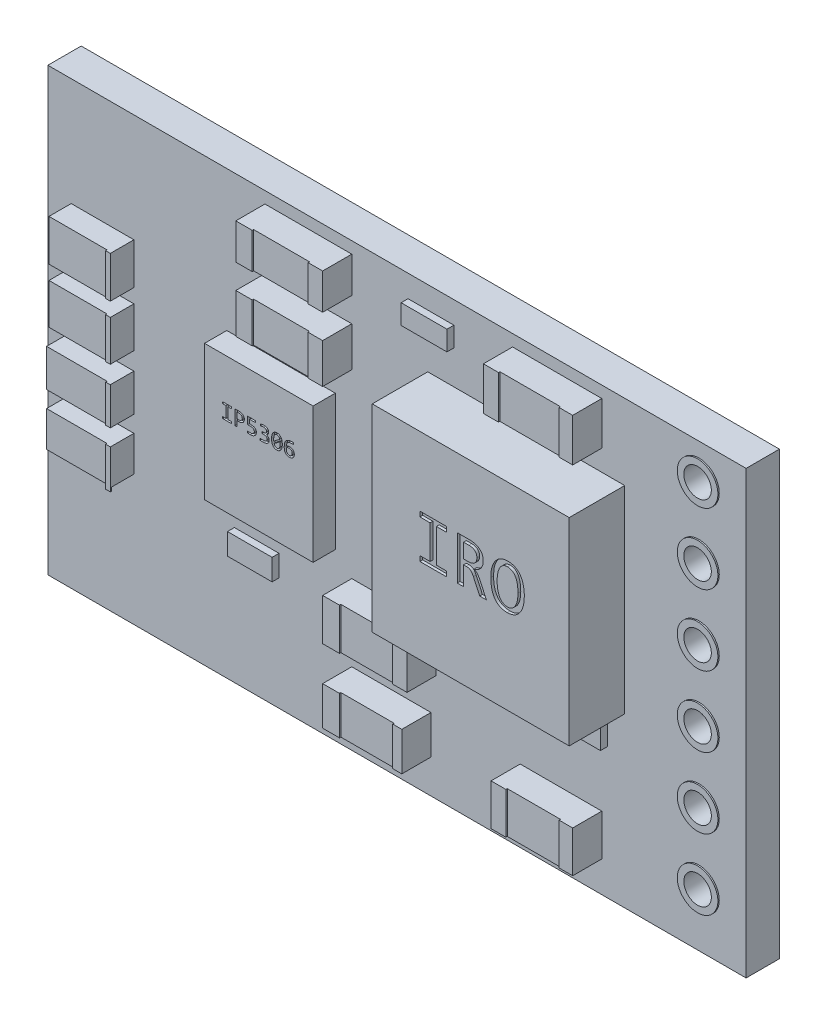
from build123d import *

# Parameters (mm, degrees)
ESQUISSE3_W             = 25.154181236
ESQUISSE3_H             = 15.900570523
BOSS_EXTRU_1_DEPTH      = 1.2
CONDO_W                 = 7.09588302
CONDO_H                 = 7.124845808
BOSS_EXTRU_2_DEPTH      = 2
IC_ET_DIODES_W          = 3.909976358
IC_ET_DIODES_H          = 4.88022975
IC_ET_DIODES_W_2        = 2.259097451
IC_ET_DIODES_H_2        = 1.491583574
IC_ET_DIODES_H_3        = 1.462620786
IC_ET_DIODES_W_3        = 2.345985815
IC_ET_DIODES_H_4        = 1.346769634
IC_ET_DIODES_H_5        = 1.274362665
BOSS_EXTRU_3_DEPTH      = 0.8
RESISTRORS_W            = 1.650878906
RESISTRORS_H            = 0.709588302
RESISTRORS_W_2          = 1.607434725
RESISTRORS_H_2          = 0.767513877
RESISTRORS_W_3          = 1.535027755
RESISTRORS_H_3          = 0.73855109
RESISTRORS_H_4          = 0.854402241
BOSS_EXTRU_4_DEPTH      = 0.25
RESISTORS_W             = 3.127981086
RESISTORS_H             = 1.288844058
RESISTORS_H_2           = 1.433657998
RESISTORS_W_2           = 3.214869449
RESISTORS_H_3           = 1.549509149
RESISTORS_W_3           = 3.041092723
RESISTORS_H_4           = 1.506064967
RESISTORS_W_4           = 2.852834602
RESISTORS_H_5           = 1.390213816
RESISTORS_W_5           = 2.939722965
RESISTORS_H_6           = 1.491583574
BOSS_EXTRU_5_DEPTH      = 1
PINS_R                  = 0.49578427
ENL_V_MAT_EXTRU_1_DEPTH = 11
ENL_V_MAT_EXTRU_4_DEPTH = 0.1
ENL_V_MAT_EXTRU_5_DEPTH = 0.1
BOSS_EXTRU_6_START      = 0.05
ESQUISSE14_R            = 0.73159052
ESQUISSE14_R_2          = 0.49578427
BOSS_EXTRU_6_DEPTH      = 0.05
CATHODE_DIODES_W        = 0.167033862
CATHODE_DIODES_H        = 1.491583574
CATHODE_DIODES_H_2      = 1.462620786
CATHODE_DIODES_H_3      = 1.346769634
CATHODE_DIODES_H_4      = 1.402853489
BOSS_EXTRU_7_DEPTH      = 0.05
SOUDURECAPA_W           = 0.59218374
SOUDURECAPA_H           = 1.288844058
SOUDURECAPA_W_2         = 0.526608544
SOUDURECAPA_H_2         = 1.433657998
SOUDURECAPA_W_3         = 0.607610942
SOUDURECAPA_H_3         = 1.506064967
SOUDURECAPA_W_4         = 0.521511792
SOUDURECAPA_W_5         = 0.333253671
SOUDURECAPA_H_4         = 1.390213816
SOUDURECAPA_W_6         = 0.535067026
SOUDURECAPA_H_5         = 1.491583574
SOUDURECAPA_W_7         = 0.492685949
SOUDURECAPA_H_6         = 1.549509149
SOUDURECAPA_W_8         = 0.542679997
BOSS_EXTRU_8_DEPTH      = 0.05


with BuildPart() as part:
    # Esquisse3 → Boss.-Extru.1 (new body)
    with BuildSketch(Plane.XY):
        with Locations((619.303098816, 274.253303188)):
            Rectangle(ESQUISSE3_W, ESQUISSE3_H)
    extrude(amount=-BOSS_EXTRU_1_DEPTH)

    # condo → Boss.-Extru.2 (add)
    with BuildSketch(Plane.XY):
        with Locations((623.958866961, 275.918663488)):
            Rectangle(CONDO_W, CONDO_H)
    extrude(amount=BOSS_EXTRU_2_DEPTH)

    # ic et diodes → Boss.-Extru.3 (add)
    with BuildSketch(Plane.XY):
        with Locations((615.12521667, 274.709467096)):
            Rectangle(IC_ET_DIODES_W, IC_ET_DIODES_H)
        with Locations((608.695477771, 277.562301698)):
            Rectangle(IC_ET_DIODES_W_2, IC_ET_DIODES_H_2)
        with Locations((608.695477771, 275.578350731)):
            Rectangle(IC_ET_DIODES_W_2, IC_ET_DIODES_H_3)
        with Locations((608.652033588, 273.536474189)):
            Rectangle(IC_ET_DIODES_W_3, IC_ET_DIODES_H_4)
        with Locations((608.652033588, 271.632170889)):
            Rectangle(IC_ET_DIODES_W_3, IC_ET_DIODES_H_5)
    extrude(amount=BOSS_EXTRU_3_DEPTH)

    # resistrors → Boss.-Extru.4 (add)
    with BuildSketch(Plane.XY):
        with Locations((620.526776602, 281.052317632)):
            Rectangle(RESISTRORS_W, RESISTRORS_H)
        with Locations((614.249092339, 270.756046556)):
            Rectangle(RESISTRORS_W_2, RESISTRORS_H_2)
        with Locations((623.292722841, 271.50907904)):
            Rectangle(RESISTRORS_W_3, RESISTRORS_H_3)
        with Locations((626.080391169, 271.451153465)):
            Rectangle(RESISTRORS_W_2, RESISTRORS_H_4)
    extrude(amount=BOSS_EXTRU_4_DEPTH)

    # resistors → Boss.-Extru.5 (add)
    with BuildSketch(Plane.XY):
        with Locations((616.109951457, 281.139205996)):
            Rectangle(RESISTORS_W, RESISTORS_H)
        with Locations((616.109951457, 278.894589939)):
            Rectangle(RESISTORS_W, RESISTORS_H_2)
        with Locations((625.073934293, 281.008873451)):
            Rectangle(RESISTORS_W_2, RESISTORS_H_3)
        with Locations((619.194488362, 270.908101192)):
            Rectangle(RESISTORS_W_3, RESISTORS_H_4)
        with Locations((619.100359301, 268.214561924)):
            Rectangle(RESISTORS_W_4, RESISTORS_H_5)
        with Locations((625.211507535, 268.163877045)):
            Rectangle(RESISTORS_W_5, RESISTORS_H_6)
    extrude(amount=BOSS_EXTRU_5_DEPTH)

    # pins → Enlèv. mat.-Extru.1 (cut)
    with BuildSketch(Plane(origin=(0, -0.129440995, 0), x_dir=(1, 0, 0), z_dir=(0, 0, 1))):
        with Locations((630.181608252, 281.075407199)):
            Circle(PINS_R)
        with Locations((630.181608252, 278.535407199)):
            Circle(PINS_R)
        with Locations((630.181608252, 275.995407199)):
            Circle(PINS_R)
        with Locations((630.181608252, 273.455407199)):
            Circle(PINS_R)
        with Locations((630.181608252, 270.915407199)):
            Circle(PINS_R)
        with Locations((630.181608252, 268.375407199)):
            Circle(PINS_R)
    extrude(amount=-ENL_V_MAT_EXTRU_1_DEPTH, mode=Mode.SUBTRACT)

    # Esquisse11 → Enlèv. mat.-Extru.4 (cut)
    # profile 1 of 6: a face of its own
    with BuildSketch(Plane.XY.offset(0.8)):
        Polygon((613.943659437, 275.592581959), (613.822152418, 275.592581959), (613.822152418, 275.653335469), (614.141108345, 275.653335469), (614.141108345, 275.592581959), (614.019601325, 275.592581959), (614.019601325, 275.190089956), (614.141108345, 275.190089956), (614.141108345, 275.129336446), (613.822152418, 275.129336446), (613.822152418, 275.190089956), (613.943659437, 275.190089956), align=None)
    # profile 2 of 6: a face of its own
    with BuildSketch(Plane.XY.offset(0.8)):
        with BuildLine():
            add(Edge.make_bspline(
                [(614.604353858, 275.493857506), (614.604225624, 275.488549272), (614.603968003, 275.477885076), (614.601589653, 275.461964649), (614.59790679, 275.446129535), (614.592847652, 275.430483861), (614.58621278, 275.415258762), (614.577921736, 275.400725624), (614.567786508, 275.387157455), (614.556321385, 275.374265392), (614.543065073, 275.362482464), (614.528080992, 275.351865944), (614.511411581, 275.342414242), (614.493106856, 275.334003464), (614.472926867, 275.327403194), (614.450927596, 275.322505311), (614.42703087, 275.319704753), (614.410472058, 275.319366061), (614.401921265, 275.319191164)],
                knots=[0, 0, 0, 0, 0.84837333, 1.704374698, 2.568122001, 3.446177459, 4.329841521, 5.219461111, 6.115085959, 7.03322926, 7.973947317, 8.94447037, 9.964314875, 11.034235969, 12.160282575, 13.352588404, 14.632904974, 16, 16, 16, 16], degree=3))
            Line((614.401921265, 275.319191164), (614.338557252, 275.319191164))
            Line((614.338557252, 275.319191164), (614.338557252, 275.129336446))
            Line((614.338557252, 275.129336446), (614.262615365, 275.129336446))
            Line((614.262615365, 275.129336446), (614.262615365, 275.653335469))
            Line((614.262615365, 275.653335469), (614.409159476, 275.653335469))
            add(Edge.make_bspline(
                [(614.409159476, 275.653335469), (614.415531854, 275.653267981), (614.428180436, 275.653134022), (614.446908151, 275.651340728), (614.46527368, 275.648814474), (614.483127512, 275.645037821), (614.50027102, 275.640083051), (614.516558049, 275.634035163), (614.531538735, 275.626146853), (614.545606031, 275.617307528), (614.558561603, 275.607103625), (614.569959101, 275.595262131), (614.58001116, 275.582070549), (614.588717117, 275.567559891), (614.595885108, 275.55148432), (614.600702545, 275.533672834), (614.603936609, 275.514305154), (614.604211514, 275.500833196), (614.604353858, 275.493857506)],
                knots=[0, 0, 0, 0, 1.071095419, 2.126025337, 3.160633674, 4.187194637, 5.191188192, 6.159546808, 7.102471747, 8.032359578, 8.950543616, 9.867691343, 10.788184798, 11.733733012, 12.707489344, 13.737062018, 14.82826569, 16, 16, 16, 16], degree=3))
        make_face()
        with BuildLine():
            add(Edge.make_bspline(
                [(614.528411971, 275.489823093), (614.528336217, 275.493862914), (614.528188569, 275.501736677), (614.526601434, 275.513139426), (614.524102145, 275.523828042), (614.520697753, 275.533793264), (614.516284427, 275.543064755), (614.510766094, 275.551515686), (614.504317591, 275.559322442), (614.496829663, 275.566300902), (614.488449435, 275.572443702), (614.479428458, 275.577996415), (614.469475892, 275.582483485), (614.458728671, 275.586120938), (614.447246147, 275.589144724), (614.434916989, 275.591047646), (614.421888757, 275.592460544), (614.412921253, 275.592540839), (614.408328861, 275.592581959)],
                knots=[0, 0, 0, 0, 1.07893025, 2.102875295, 3.069403633, 4.00867391, 4.911619206, 5.805799344, 6.69897942, 7.61127936, 8.532960211, 9.47193309, 10.436783978, 11.442898866, 12.50165651, 13.605056338, 14.773513735, 16, 16, 16, 16], degree=3))
            Line((614.408328861, 275.592581959), (614.338557252, 275.592581959))
            Line((614.338557252, 275.592581959), (614.338557252, 275.379944674))
            Line((614.338557252, 275.379944674), (614.402277242, 275.379944674))
            add(Edge.make_bspline(
                [(614.402277242, 275.379944674), (614.407184005, 275.380051101), (614.416695595, 275.380257405), (614.430579549, 275.38141367), (614.443609499, 275.383493416), (614.455726377, 275.38662189), (614.466982343, 275.390399006), (614.477397495, 275.395012873), (614.486918134, 275.400632173), (614.495619008, 275.407037175), (614.503440117, 275.414289309), (614.510082966, 275.422583639), (614.515831676, 275.431631098), (614.520504453, 275.441595565), (614.524001975, 275.452458539), (614.526627385, 275.464128227), (614.528188477, 275.476688656), (614.528335841, 275.485349072), (614.528411971, 275.489823093)],
                knots=[0, 0, 0, 0, 1.232805628, 2.389751021, 3.4973379, 4.54330244, 5.530003372, 6.477393866, 7.399377973, 8.301660217, 9.187431021, 10.070466494, 10.963674817, 11.874940633, 12.827061481, 13.825105319, 14.876436953, 16, 16, 16, 16], degree=3))
        make_face(mode=Mode.SUBTRACT)
    # profile 3 of 6: a face of its own
    with BuildSketch(Plane.XY.offset(0.8)):
        with BuildLine():
            add(Edge.make_bspline(
                [(615.037222617, 275.298425805), (615.037011266, 275.292006635), (615.036595186, 275.279369449), (615.033481681, 275.260811899), (615.028104221, 275.243174523), (615.020667033, 275.226499159), (615.011540979, 275.210802293), (615.000671507, 275.196267805), (614.988221604, 275.182907411), (614.974289935, 275.170639812), (614.958895129, 275.159642135), (614.942039038, 275.149973932), (614.923973571, 275.141438721), (614.904577658, 275.134363671), (614.88423918, 275.128657821), (614.862963957, 275.124625051), (614.840896568, 275.122238483), (614.825896445, 275.121909129), (614.818296394, 275.121742257)],
                knots=[0, 0, 0, 0, 0.98172717, 1.932690758, 2.868675772, 3.79512682, 4.719778069, 5.640699909, 6.565489728, 7.508663867, 8.475813283, 9.454477684, 10.477621026, 11.528583183, 12.609071962, 13.705570848, 14.837491085, 16, 16, 16, 16], degree=3))
            add(Edge.make_bspline(
                [(614.818296394, 275.121742257), (614.814261726, 275.121761394), (614.805912806, 275.121800994), (614.793130256, 275.122263345), (614.779972995, 275.123216151), (614.766740262, 275.12387457), (614.753709358, 275.125220858), (614.741108957, 275.126258955), (614.729322241, 275.127691832), (614.721824289, 275.128807221), (614.71826669, 275.129336446)],
                knots=[0, 0, 0, 0, 0.964491421, 1.995817636, 3.056882487, 4.117947338, 5.162324201, 6.187869467, 7.140187366, 8, 8, 8, 8], degree=3))
            Line((614.71826669, 275.129336446), (614.71826669, 275.190089956))
            add(Edge.make_bspline(
                [(614.71826669, 275.190089956), (614.725927911, 275.188849085), (614.742217076, 275.186210764), (614.767950758, 275.184074589), (614.795342052, 275.182802907), (614.814023089, 275.182598403), (614.82339874, 275.182495767)],
                knots=[0, 0, 0, 0, 0.882238515, 1.875801315, 2.933905742, 4, 4, 4, 4], degree=3))
            add(Edge.make_bspline(
                [(614.82339874, 275.182495767), (614.828582722, 275.182587956), (614.838733679, 275.182768475), (614.85354381, 275.184143839), (614.867517566, 275.186715429), (614.880717176, 275.189965548), (614.893032695, 275.194211105), (614.904412018, 275.199372357), (614.914879907, 275.205243843), (614.924328038, 275.21207772), (614.932784612, 275.219659304), (614.940170543, 275.228059838), (614.946691614, 275.237079371), (614.951881017, 275.247026616), (614.956049319, 275.257649775), (614.959148295, 275.268892719), (614.960957102, 275.280805644), (614.961171119, 275.28892684), (614.961280729, 275.293086141)],
                knots=[0, 0, 0, 0, 1.24924794, 2.446200838, 3.579242984, 4.670415696, 5.719433635, 6.713395331, 7.678134183, 8.606690161, 9.517812713, 10.409125339, 11.297783723, 12.193215167, 13.104786339, 14.043608292, 14.99802676, 16, 16, 16, 16], degree=3))
            add(Edge.make_bspline(
                [(614.961280729, 275.293086141), (614.961149789, 275.297084301), (614.960897255, 275.304795182), (614.959437136, 275.316020423), (614.956519284, 275.326293047), (614.952779228, 275.335857241), (614.947692199, 275.344400007), (614.941744459, 275.352318223), (614.934413412, 275.359132809), (614.926126371, 275.36524954), (614.916854089, 275.370592334), (614.906537983, 275.375046821), (614.895369743, 275.378980548), (614.883235998, 275.38219802), (614.870083979, 275.384487569), (614.856030476, 275.386272755), (614.840977007, 275.387351363), (614.830638737, 275.387474989), (614.825297287, 275.387538863)],
                knots=[0, 0, 0, 0, 1.018778499, 1.96482378, 2.874050982, 3.732757355, 4.572520443, 5.398697291, 6.246699149, 7.111119102, 8.018334738, 8.965559426, 9.969232179, 11.032231485, 12.15860358, 13.366965149, 14.639596152, 16, 16, 16, 16], degree=3))
            Line((614.825297287, 275.387538863), (614.725860878, 275.387538863))
            Line((614.725860878, 275.387538863), (614.725860878, 275.653335469))
            Line((614.725860878, 275.653335469), (615.006845862, 275.653335469))
            Line((615.006845862, 275.653335469), (615.006845862, 275.592581959))
            Line((615.006845862, 275.592581959), (614.794208577, 275.592581959))
            Line((614.794208577, 275.592581959), (614.794208577, 275.448292373))
            Line((614.794208577, 275.448292373), (614.83965505, 275.448292373))
            add(Edge.make_bspline(
                [(614.83965505, 275.448292373), (614.845865847, 275.448177375), (614.858179613, 275.447949377), (614.876573431, 275.446846544), (614.894643573, 275.444472556), (614.912424255, 275.44162742), (614.929661476, 275.43768796), (614.945972331, 275.432234822), (614.961335882, 275.42551575), (614.975739166, 275.417638965), (614.988970707, 275.408217059), (615.000975782, 275.397382144), (615.011422844, 275.384887263), (615.020677679, 275.371059512), (615.028307593, 275.355540093), (615.033402722, 275.338040091), (615.036684094, 275.318839965), (615.03703859, 275.305401817), (615.037222617, 275.298425805)],
                knots=[0, 0, 0, 0, 1.059175612, 2.099962526, 3.139743828, 4.165320853, 5.169746916, 6.150783593, 7.093036138, 8.02582832, 8.944668115, 9.856526481, 10.775316774, 11.714305364, 12.688572902, 13.710506815, 14.811478169, 16, 16, 16, 16], degree=3))
        make_face()
    # profile 4 of 6: a face of its own
    with BuildSketch(Plane.XY.offset(0.8)):
        with BuildLine():
            add(Edge.make_bspline(
                [(615.50046813, 275.290594297), (615.50026642, 275.284850561), (615.499866493, 275.273462542), (615.497254104, 275.256639587), (615.492659813, 275.240390019), (615.486425833, 275.22470479), (615.478250652, 275.20983281), (615.468552428, 275.195686643), (615.456748503, 275.182740641), (615.443332746, 275.17068219), (615.427977814, 275.159900566), (615.410955466, 275.15008408), (615.391939081, 275.141725845), (615.371164428, 275.134496731), (615.348605944, 275.128639979), (615.324209864, 275.124738363), (615.298090584, 275.122169424), (615.28004548, 275.121887552), (615.270743921, 275.121742257)],
                knots=[0, 0, 0, 0, 0.861844565, 1.708766071, 2.546803722, 3.390976017, 4.235482026, 5.088267806, 5.958166408, 6.857625573, 7.789680516, 8.767975323, 9.801402493, 10.901266619, 12.065759824, 13.293144602, 14.604719897, 16, 16, 16, 16], degree=3))
            add(Edge.make_bspline(
                [(615.270743921, 275.121742257), (615.260695496, 275.121863101), (615.241653814, 275.122092099), (615.214451952, 275.123604694), (615.189699415, 275.126196294), (615.173952934, 275.128311592), (615.166323825, 275.129336446)],
                knots=[0, 0, 0, 0, 1.150713897, 2.180593327, 3.118504498, 4, 4, 4, 4], degree=3))
            Line((615.166323825, 275.129336446), (615.166323825, 275.190089956))
            add(Edge.make_bspline(
                [(615.166323825, 275.190089956), (615.174940223, 275.188969686), (615.192576847, 275.186676641), (615.21971892, 275.184171125), (615.247867242, 275.182776637), (615.266945359, 275.182589872), (615.276558222, 275.182495767)],
                knots=[0, 0, 0, 0, 0.942811003, 1.929809335, 2.956896058, 4, 4, 4, 4], degree=3))
            add(Edge.make_bspline(
                [(615.276558222, 275.182495767), (615.282928102, 275.182594066), (615.295246753, 275.182784166), (615.312967064, 275.184026675), (615.329251259, 275.186300917), (615.344127498, 275.189352892), (615.357685523, 275.193210772), (615.369915656, 275.197994469), (615.380844354, 275.203506098), (615.390451335, 275.209875662), (615.398881313, 275.216899479), (615.406003841, 275.224742965), (615.411917332, 275.233279887), (615.416568137, 275.242525211), (615.42008755, 275.252431095), (615.422736244, 275.262950262), (615.424285128, 275.27409378), (615.424444991, 275.281729633), (615.424526243, 275.285610611)],
                knots=[0, 0, 0, 0, 1.490140128, 2.881768065, 4.152352525, 5.333691038, 6.431800578, 7.445549096, 8.401444764, 9.289364022, 10.136425943, 10.961731228, 11.759931868, 12.558561418, 13.375159002, 14.214453508, 15.092482988, 16, 16, 16, 16], degree=3))
            add(Edge.make_bspline(
                [(615.424526243, 275.285610611), (615.424415862, 275.289137652), (615.424201039, 275.296001976), (615.422427458, 275.305968217), (615.419281664, 275.315153851), (615.415128286, 275.323676512), (615.409803577, 275.331424322), (615.403629076, 275.33863227), (615.396317942, 275.345032855), (615.388049653, 275.35075386), (615.378904481, 275.355775366), (615.369017726, 275.360410791), (615.358142386, 275.363964924), (615.346548825, 275.367094358), (615.334235637, 275.36936413), (615.321343344, 275.371244893), (615.307856513, 275.372106859), (615.298669123, 275.372268406), (615.294001124, 275.372350486)],
                knots=[0, 0, 0, 0, 0.962645216, 1.873499504, 2.751163712, 3.60600831, 4.45366029, 5.311093063, 6.190880762, 7.098592726, 8.05100711, 9.036815858, 10.075001357, 11.16993685, 12.313633837, 13.491143935, 14.725281481, 16, 16, 16, 16], degree=3))
            Line((615.294001124, 275.372350486), (615.234671524, 275.372350486))
            Line((615.234671524, 275.372350486), (615.234671524, 275.433103996))
            Line((615.234671524, 275.433103996), (615.295781012, 275.433103996))
            add(Edge.make_bspline(
                [(615.295781012, 275.433103996), (615.299660613, 275.433159205), (615.30728071, 275.433267646), (615.318421086, 275.434506159), (615.329050635, 275.436391117), (615.339134744, 275.438987243), (615.348640323, 275.442281143), (615.357413944, 275.446309251), (615.36549327, 275.45098505), (615.372821281, 275.45633978), (615.379565282, 275.462213547), (615.385238737, 275.46899183), (615.390320753, 275.47624212), (615.394424486, 275.484246534), (615.397838942, 275.492797519), (615.399990637, 275.502042663), (615.401495314, 275.511765353), (615.401659844, 275.518453356), (615.401743677, 275.521861077)],
                knots=[0, 0, 0, 0, 1.192823995, 2.342878639, 3.443008352, 4.511191983, 5.54236148, 6.533123054, 7.476280357, 8.408308338, 9.321648148, 10.218966078, 11.119987697, 12.039625921, 12.979481887, 13.944359475, 14.9525951, 16, 16, 16, 16], degree=3))
            add(Edge.make_bspline(
                [(615.401743677, 275.521861077), (615.401700952, 275.525149358), (615.401617705, 275.531556372), (615.400241904, 275.540765013), (615.398258741, 275.549330211), (615.395420543, 275.557193397), (615.391726452, 275.564384474), (615.387177518, 275.570855716), (615.381790114, 275.576615619), (615.375536087, 275.581585945), (615.368590596, 275.586027203), (615.360822812, 275.589831193), (615.352275792, 275.592933725), (615.343048057, 275.595789679), (615.333011055, 275.597693053), (615.322232364, 275.599091771), (615.310711936, 275.600118962), (615.302744771, 275.600156668), (615.298628833, 275.600176148)],
                knots=[0, 0, 0, 0, 1.064287749, 2.073699511, 3.009236736, 3.9091673, 4.774588449, 5.620725501, 6.46384913, 7.320401755, 8.201989857, 9.130391188, 10.115765889, 11.145550715, 12.256343534, 13.419843727, 14.667058473, 16, 16, 16, 16], degree=3))
            add(Edge.make_bspline(
                [(615.298628833, 275.600176148), (615.289476683, 275.599890997), (615.270761502, 275.599307893), (615.247308276, 275.59555965), (615.228038168, 275.591324469), (615.212961725, 275.587389098), (615.197371083, 275.582751252), (615.186880559, 275.579207196), (615.181512203, 275.577393582)],
                knots=[0, 0, 0, 0, 1.374009053, 2.809703548, 3.557729416, 4.33717134, 5.149074242, 6, 6, 6, 6], degree=3))
            Line((615.181512203, 275.577393582), (615.181512203, 275.638147092))
            add(Edge.make_bspline(
                [(615.181512203, 275.638147092), (615.186319271, 275.639903359), (615.196123838, 275.643485468), (615.211369763, 275.647875951), (615.226997888, 275.651788815), (615.242808998, 275.654951506), (615.258550498, 275.657605596), (615.274152621, 275.659462195), (615.289391658, 275.660741878), (615.299417429, 275.660867952), (615.304324474, 275.660929658)],
                knots=[0, 0, 0, 0, 0.978322217, 1.995400233, 3.031781794, 4.058180853, 5.077730371, 6.083355555, 7.06191161, 8, 8, 8, 8], degree=3))
            add(Edge.make_bspline(
                [(615.304324474, 275.660929658), (615.311250066, 275.660816633), (615.324647461, 275.66059799), (615.344103098, 275.658893495), (615.362282341, 275.656254249), (615.379187877, 275.652347163), (615.394743819, 275.647322335), (615.40911089, 275.641581323), (615.422076218, 275.634694057), (615.433701968, 275.626821634), (615.443949192, 275.617997796), (615.452958672, 275.608324558), (615.460590885, 275.597729555), (615.466794382, 275.586221227), (615.471641219, 275.573944026), (615.4752834, 275.560919831), (615.477253328, 275.54707718), (615.477539529, 275.537608921), (615.477685564, 275.532777723)],
                knots=[0, 0, 0, 0, 1.364346343, 2.639295939, 3.84503498, 4.981142705, 6.053223054, 7.063352329, 8.025569508, 8.939887992, 9.824051135, 10.684331437, 11.538625567, 12.389464824, 13.253408307, 14.134440564, 15.048094572, 16, 16, 16, 16], degree=3))
            add(Edge.make_bspline(
                [(615.477685564, 275.532777723), (615.477444248, 275.525672018), (615.47697679, 275.511907376), (615.472437702, 275.492138597), (615.465124014, 275.474073586), (615.454530568, 275.458021382), (615.441567756, 275.443714505), (615.426420567, 275.430981166), (615.409270345, 275.419507728), (615.396534845, 275.413594573), (615.389996416, 275.410558748)],
                knots=[0, 0, 0, 0, 1.062433809, 2.058067584, 3.019272504, 3.965418163, 4.921501302, 5.900439357, 6.922081703, 8, 8, 8, 8], degree=3))
            add(Edge.make_bspline(
                [(615.389996416, 275.410558748), (615.396787601, 275.409162183), (615.410560071, 275.406329962), (615.430213925, 275.397812182), (615.448920697, 275.386898373), (615.462859412, 275.3751657), (615.472857537, 275.364619171), (615.479587957, 275.355916813), (615.485747161, 275.34662147), (615.490912994, 275.336541843), (615.495224354, 275.325885511), (615.498347289, 275.314632034), (615.500136849, 275.302795121), (615.500356274, 275.294713864), (615.50046813, 275.290594297)],
                knots=[0, 0, 0, 0, 1.405413986, 2.85016813, 4.327699737, 5.794019892, 6.533135325, 7.277475483, 8.026443619, 8.795662385, 9.574684764, 10.358501172, 11.163216512, 12, 12, 12, 12], degree=3))
        make_face()
    # profile 5 of 6: a face of its own
    with BuildSketch(Plane.XY.offset(0.8)):
        with BuildLine():
            add(Edge.make_bspline(
                [(615.971307833, 275.391098639), (615.971199591, 275.381283863), (615.970987571, 275.362059058), (615.968495819, 275.333937619), (615.9647737, 275.307096571), (615.959457857, 275.281637026), (615.952712858, 275.257646625), (615.944053402, 275.235416588), (615.934064699, 275.214850074), (615.922395283, 275.196098572), (615.909200599, 275.179289093), (615.894470608, 275.164385627), (615.878181026, 275.151532243), (615.860327338, 275.140774691), (615.840976156, 275.132081572), (615.819904632, 275.126146856), (615.797294471, 275.122328777), (615.781667218, 275.121941595), (615.773621607, 275.121742257)],
                knots=[0, 0, 0, 0, 1.248871528, 2.446241243, 3.590357027, 4.69618527, 5.754202854, 6.758290001, 7.728669934, 8.660396172, 9.563796911, 10.443071522, 11.321307858, 12.197637495, 13.090115231, 14.012601613, 14.976798049, 16, 16, 16, 16], degree=3))
            add(Edge.make_bspline(
                [(615.773621607, 275.121742257), (615.766650033, 275.121911967), (615.752918294, 275.122246241), (615.732816697, 275.125261437), (615.71370443, 275.13029369), (615.695546787, 275.137106969), (615.678561669, 275.146215958), (615.662838526, 275.15744523), (615.64830995, 275.170740144), (615.63522424, 275.186334028), (615.623451518, 275.204068403), (615.613238987, 275.224136911), (615.604409629, 275.246353641), (615.596871697, 275.270810348), (615.591182523, 275.29762717), (615.586908587, 275.326709605), (615.584449095, 275.358148031), (615.58415593, 275.379861253), (615.584004206, 275.391098639)],
                knots=[0, 0, 0, 0, 0.897102697, 1.767001224, 2.609309556, 3.43771295, 4.257811968, 5.082953918, 5.919052252, 6.786174452, 7.6970727, 8.653553743, 9.679470751, 10.771494031, 11.944028827, 13.204944144, 14.553456404, 16, 16, 16, 16], degree=3))
            add(Edge.make_bspline(
                [(615.584004206, 275.391098639), (615.584181071, 275.400911491), (615.58452814, 275.420167714), (615.586735344, 275.448394878), (615.590668483, 275.475300958), (615.596068432, 275.500809013), (615.603032703, 275.524828084), (615.611539637, 275.547147321), (615.621519133, 275.56772059), (615.633059222, 275.58649731), (615.646195248, 275.603372428), (615.660965763, 275.618279637), (615.677266367, 275.631175743), (615.695228451, 275.641895154), (615.714661189, 275.65056947), (615.735725301, 275.656512839), (615.758214746, 275.660338422), (615.773723884, 275.66072902), (615.781690432, 275.660929658)],
                knots=[0, 0, 0, 0, 1.248165713, 2.449334701, 3.598380242, 4.704508407, 5.763215836, 6.776019403, 7.739017366, 8.667464557, 9.574217704, 10.452902578, 11.330549874, 12.210601904, 13.107080692, 14.028948355, 14.987533857, 16, 16, 16, 16], degree=3))
            add(Edge.make_bspline(
                [(615.781690432, 275.660929658), (615.78866217, 275.660759948), (615.802394232, 275.660425675), (615.822455557, 275.657416165), (615.841554347, 275.652396076), (615.859639379, 275.645381057), (615.876717238, 275.636415863), (615.892398545, 275.625061507), (615.906888383, 275.611692671), (615.919939471, 275.595995149), (615.931755353, 275.578196526), (615.942061675, 275.558170594), (615.950806807, 275.535872107), (615.958252851, 275.511441689), (615.96419151, 275.484671531), (615.968386392, 275.455602615), (615.970870868, 275.424129487), (615.971158645, 275.402375962), (615.971307833, 275.391098639)],
                knots=[0, 0, 0, 0, 0.896490568, 1.765795528, 2.602608418, 3.432274242, 4.256303472, 5.076742829, 5.915718828, 6.786140009, 7.696416714, 8.659101079, 9.677705081, 10.773848187, 11.941709476, 13.20176442, 14.549356535, 16, 16, 16, 16], degree=3))
        make_face()
        with BuildLine():
            add(Edge.make_bspline(
                [(615.895365945, 275.387064226), (615.895339119, 275.391614874), (615.895285655, 275.400684413), (615.894274903, 275.414199551), (615.893430026, 275.427539687), (615.892581195, 275.436349151), (615.892162147, 275.440698184)],
                knots=[0, 0, 0, 0, 1.015676625, 2.024265076, 3.024624451, 4, 4, 4, 4], degree=3))
            Line((615.892162147, 275.440698184), (615.674778494, 275.273626032))
            add(Edge.make_bspline(
                [(615.674778494, 275.273626032), (615.676918326, 275.267215445), (615.68111541, 275.254641666), (615.689214728, 275.236915561), (615.699142231, 275.221083666), (615.711076458, 275.207605101), (615.724952275, 275.196780915), (615.737873621, 275.189874072), (615.749144956, 275.18614067), (615.758178725, 275.183939807), (615.767819433, 275.182824781), (615.774410414, 275.182606954), (615.777774679, 275.182495767)],
                knots=[0, 0, 0, 0, 1.361870802, 2.671184605, 3.91877896, 5.116024374, 6.280451232, 7.450298556, 8.047911377, 8.670688444, 9.321473259, 10, 10, 10, 10], degree=3))
            add(Edge.make_bspline(
                [(615.777774679, 275.182495767), (615.782138998, 275.182646453), (615.790743183, 275.182943529), (615.80329592, 275.185571516), (615.815276249, 275.189547913), (615.826541778, 275.195379576), (615.837171536, 275.202697031), (615.846758766, 275.21190976), (615.855785983, 275.222400367), (615.863809064, 275.234607335), (615.871040521, 275.248328186), (615.877474361, 275.263598342), (615.882858377, 275.280452109), (615.887337542, 275.298860353), (615.891023699, 275.31873765), (615.893580702, 275.340178127), (615.895142497, 275.363111011), (615.895289912, 275.378913656), (615.895365945, 275.387064226)],
                knots=[0, 0, 0, 0, 0.796240393, 1.569775284, 2.332781704, 3.095240773, 3.878796528, 4.681173991, 5.516437293, 6.40201063, 7.34239963, 8.345981007, 9.424260963, 10.57011489, 11.804224653, 13.114209461, 14.5115885, 16, 16, 16, 16], degree=3))
        make_face(mode=Mode.SUBTRACT)
        with BuildLine():
            add(Edge.make_bspline(
                [(615.659946094, 275.391929253), (615.659941159, 275.387697053), (615.659931289, 275.379232467), (615.660004871, 275.366612175), (615.660423497, 275.354178922), (615.661136775, 275.346005833), (615.661488664, 275.341973731)],
                knots=[0, 0, 0, 0, 1.015676347, 2.03139705, 3.028811753, 4, 4, 4, 4], degree=3))
            Line((615.661488664, 275.341973731), (615.878990976, 275.509045883))
            add(Edge.make_bspline(
                [(615.878990976, 275.509045883), (615.876933933, 275.515554198), (615.872933656, 275.528210749), (615.864461682, 275.545708417), (615.854785701, 275.561499933), (615.842852285, 275.574762805), (615.829346825, 275.585855391), (615.816440692, 275.592582232), (615.805399787, 275.596547396), (615.796539514, 275.598724884), (615.787177433, 275.599844237), (615.780783232, 275.600064392), (615.77753736, 275.600176148)],
                knots=[0, 0, 0, 0, 1.387569518, 2.698370158, 3.946895934, 5.144331536, 6.312393877, 7.486406228, 8.084826247, 8.697958228, 9.339048001, 10, 10, 10, 10], degree=3))
            add(Edge.make_bspline(
                [(615.77753736, 275.600176148), (615.773174584, 275.600020954), (615.764573439, 275.599714992), (615.752022531, 275.597156801), (615.740096253, 275.592933829), (615.728784568, 275.587092348), (615.718135551, 275.579609808), (615.708523185, 275.570236736), (615.699361682, 275.559572887), (615.691400847, 275.546975251), (615.684155867, 275.532968677), (615.677837187, 275.517349086), (615.672491866, 275.500181834), (615.667795899, 275.481505429), (615.664332873, 275.461266894), (615.661718077, 275.439529118), (615.660173821, 275.416237323), (615.660023561, 275.400198183), (615.659946094, 275.391929253)],
                knots=[0, 0, 0, 0, 0.786453526, 1.550480632, 2.299704824, 3.062398082, 3.840423392, 4.637837687, 5.478332318, 6.370910143, 7.318703432, 8.320397478, 9.40580758, 10.560070273, 11.791787257, 13.106920475, 14.508481623, 16, 16, 16, 16], degree=3))
        make_face(mode=Mode.SUBTRACT)
    # profile 6 of 6: a face of its own
    with BuildSketch(Plane.XY.offset(0.8)):
        with BuildLine():
            add(Edge.make_bspline(
                [(616.404176591, 275.297120553), (616.404028696, 275.291098094), (616.403737434, 275.27923756), (616.401066515, 275.261739619), (616.397189, 275.244745133), (616.391230801, 275.22848258), (616.384084068, 275.212931498), (616.375369765, 275.198372149), (616.365197495, 275.184876319), (616.353694359, 275.172451733), (616.340958519, 275.161080569), (616.326881096, 275.151108114), (616.311557559, 275.142413408), (616.295109567, 275.134938084), (616.277521105, 275.128949348), (616.258919413, 275.12492743), (616.239442559, 275.122142226), (616.226119012, 275.121877588), (616.219305559, 275.121742257)],
                knots=[0, 0, 0, 0, 1.012808932, 1.994609757, 2.972975015, 3.941440875, 4.903296596, 5.849619333, 6.790801589, 7.742283599, 8.694696427, 9.658806519, 10.639614075, 11.655415064, 12.695226034, 13.759400434, 14.854192403, 16, 16, 16, 16], degree=3))
            add(Edge.make_bspline(
                [(616.219305559, 275.121742257), (616.212216437, 275.121880323), (616.198422156, 275.122148977), (616.178405061, 275.124847025), (616.159615352, 275.129055114), (616.142089842, 275.135118272), (616.125805002, 275.142931108), (616.110946826, 275.152787547), (616.097471473, 275.16447846), (616.085389137, 275.178059445), (616.074652058, 275.1934609), (616.065453964, 275.21080452), (616.057457528, 275.22989221), (616.050964967, 275.250919385), (616.045902345, 275.273902689), (616.042309869, 275.298848616), (616.039988437, 275.325792221), (616.039769181, 275.344420888), (616.039655531, 275.354076969)],
                knots=[0, 0, 0, 0, 1.01390526, 1.972895057, 2.884568607, 3.765231935, 4.620839519, 5.462251428, 6.308844341, 7.166658115, 8.056926892, 8.988826794, 9.970611799, 11.014270175, 12.133424014, 13.334894011, 14.618554971, 16, 16, 16, 16], degree=3))
            add(Edge.make_bspline(
                [(616.039655531, 275.354076969), (616.03988617, 275.367259219), (616.040340945, 275.393252145), (616.0438682, 275.425380803), (616.047850618, 275.450336054), (616.051976085, 275.468360275), (616.056660938, 275.485904548), (616.062367697, 275.502864764), (616.068960028, 275.51922208), (616.076617919, 275.534881716), (616.085243955, 275.549827825), (616.09499721, 275.564032299), (616.105977914, 275.577343685), (616.118009322, 275.589856073), (616.131501376, 275.601167723), (616.146081484, 275.611657453), (616.162088587, 275.621064629), (616.179459272, 275.629332835), (616.198127186, 275.636593012), (616.218201883, 275.642638513), (616.239753422, 275.64754637), (616.262923649, 275.650908065), (616.287696179, 275.65292908), (616.30473618, 275.653197228), (616.313520963, 275.653335469)],
                knots=[0, 0, 0, 0, 1.867837564, 3.683025348, 4.575164874, 5.448344215, 6.302400058, 7.148024228, 7.982932617, 8.800284449, 9.616635944, 10.426804332, 11.239354919, 12.06000687, 12.8833352, 13.73118636, 14.6032312, 15.510928969, 16.455180552, 17.43944001, 18.479844542, 19.585049888, 20.754999322, 22, 22, 22, 22], degree=3))
            Line((616.313520963, 275.653335469), (616.366205647, 275.653335469))
            Line((616.366205647, 275.653335469), (616.366205647, 275.592581959))
            Line((616.366205647, 275.592581959), (616.30948655, 275.592581959))
            add(Edge.make_bspline(
                [(616.30948655, 275.592581959), (616.301846727, 275.59245859), (616.2870496, 275.592219642), (616.265684414, 275.59001282), (616.245800114, 275.586701235), (616.227533939, 275.581651782), (616.210702859, 275.575538797), (616.195378485, 275.568107532), (616.181407815, 275.55959263), (616.168937518, 275.54980341), (616.157734794, 275.539042265), (616.14801834, 275.527146818), (616.139598069, 275.514185488), (616.132644318, 275.500141721), (616.126943569, 275.485190769), (616.122642226, 275.469341686), (616.11904813, 275.452768277), (616.117862104, 275.441308152), (616.117258647, 275.43547718)],
                knots=[0, 0, 0, 0, 1.316020563, 2.548923235, 3.697425437, 4.785341311, 5.809590547, 6.778921485, 7.715223745, 8.623216841, 9.50526042, 10.386645473, 11.263804248, 12.162955214, 13.081906609, 14.016222334, 14.990643414, 16, 16, 16, 16], degree=3))
            Line((616.117258647, 275.43547718), (616.115597419, 275.425509807))
            add(Edge.make_bspline(
                [(616.115597419, 275.425509807), (616.11996376, 275.427734599), (616.128847201, 275.432260999), (616.142914115, 275.438256142), (616.158040986, 275.443251571), (616.17401096, 275.447796278), (616.190838668, 275.451494118), (616.208403644, 275.454059439), (616.226632582, 275.455653851), (616.238999626, 275.455808087), (616.245291923, 275.455886562)],
                knots=[0, 0, 0, 0, 0.873975351, 1.778126535, 2.724085452, 3.713532888, 4.738948549, 5.794572503, 6.877888282, 8, 8, 8, 8], degree=3))
            add(Edge.make_bspline(
                [(616.245291923, 275.455886562), (616.251707106, 275.455771139), (616.264144894, 275.455547356), (616.282170866, 275.453214791), (616.298988185, 275.449587488), (616.314580727, 275.444497747), (616.328910016, 275.438037397), (616.342039684, 275.43046463), (616.353891894, 275.421602433), (616.364445764, 275.411618742), (616.373846568, 275.400587221), (616.3818646, 275.388426611), (616.388842882, 275.375311682), (616.39434098, 275.361138097), (616.398727011, 275.346167524), (616.401935258, 275.330456522), (616.403876152, 275.314019268), (616.404075234, 275.302821543), (616.404176591, 275.297120553)],
                knots=[0, 0, 0, 0, 1.208685624, 2.343405611, 3.419797389, 4.447794122, 5.428919399, 6.377784689, 7.299336412, 8.211794848, 9.111090145, 10.025100823, 10.952275575, 11.906224264, 12.885336044, 13.889893727, 14.925701893, 16, 16, 16, 16], degree=3))
        make_face()
        with BuildLine():
            add(Edge.make_bspline(
                [(616.328234704, 275.296052621), (616.328169801, 275.300050014), (616.328042967, 275.307861888), (616.326953325, 275.319279778), (616.325197831, 275.330111184), (616.32270968, 275.340308768), (616.319575284, 275.349910725), (616.315373606, 275.358658051), (616.310509161, 275.366774966), (616.304620535, 275.37397507), (616.29810158, 275.380596224), (616.290684108, 275.386281911), (616.282488019, 275.391223649), (616.273482879, 275.395324263), (616.263613266, 275.39873857), (616.252813656, 275.401023505), (616.241099799, 275.402484966), (616.232995656, 275.402644575), (616.228798295, 275.402727241)],
                knots=[0, 0, 0, 0, 1.150520734, 2.248395983, 3.298528891, 4.306519537, 5.267901315, 6.199977448, 7.094361736, 7.985260264, 8.870904429, 9.763692766, 10.667808702, 11.620520663, 12.607126569, 13.668007045, 14.792196064, 16, 16, 16, 16], degree=3))
            add(Edge.make_bspline(
                [(616.228798295, 275.402727241), (616.223766386, 275.402597588), (616.21357394, 275.402334968), (616.198339519, 275.399936543), (616.183148953, 275.396399799), (616.168269038, 275.391620022), (616.153826001, 275.385979729), (616.140182584, 275.379422638), (616.127330038, 275.372560919), (616.119436221, 275.367309895), (616.115597419, 275.364756297)],
                knots=[0, 0, 0, 0, 0.996946629, 2.019377751, 3.050253168, 4.086838532, 5.114847083, 6.121490909, 7.086471756, 8, 8, 8, 8], degree=3))
            add(Edge.make_bspline(
                [(616.115597419, 275.364756297), (616.115693201, 275.35640916), (616.115876721, 275.340415948), (616.117127015, 275.317483078), (616.119378327, 275.296694372), (616.122360988, 275.277960175), (616.126440539, 275.261198842), (616.131235219, 275.24620885), (616.136896635, 275.232937776), (616.143448032, 275.221416979), (616.150842354, 275.211493923), (616.159250788, 275.203290862), (616.168310411, 275.196368129), (616.178340492, 275.191135273), (616.189092104, 275.187228414), (616.2006075, 275.184528344), (616.212887433, 275.182835341), (616.221356591, 275.182611111), (616.225713155, 275.182495767)],
                knots=[0, 0, 0, 0, 1.650077294, 3.161567569, 4.537910215, 5.782191403, 6.908651052, 7.944673017, 8.890238795, 9.755310799, 10.559096379, 11.327615804, 12.070408139, 12.804923978, 13.554434846, 14.326288083, 15.139036615, 16, 16, 16, 16], degree=3))
            add(Edge.make_bspline(
                [(616.225713155, 275.182495767), (616.229397464, 275.182577349), (616.236597013, 275.182736769), (616.247144359, 275.184270709), (616.257278516, 275.186426587), (616.266901938, 275.189776897), (616.275938043, 275.194087417), (616.284445137, 275.199153973), (616.292166871, 275.205306505), (616.299340909, 275.212172817), (616.305735474, 275.219993846), (616.311644322, 275.228470996), (616.316385172, 275.237992128), (616.320799222, 275.248055375), (616.324012372, 275.259037375), (616.326586037, 275.270716007), (616.327960909, 275.283164984), (616.328142209, 275.291698872), (616.328234704, 275.296052621)],
                knots=[0, 0, 0, 0, 1.025083503, 2.003127546, 2.96226617, 3.906046368, 4.832121212, 5.74620198, 6.656027477, 7.575003842, 8.505585477, 9.464660881, 10.444810511, 11.461340613, 12.520347712, 13.624044888, 14.787854947, 16, 16, 16, 16], degree=3))
        make_face(mode=Mode.SUBTRACT)
    extrude(amount=-ENL_V_MAT_EXTRU_4_DEPTH, mode=Mode.SUBTRACT)

    # Esquisse13 → Enlèv. mat.-Extru.5 (cut)
    # profile 1 of 3: a face of its own
    with BuildSketch(Plane.XY.offset(2)):
        Polygon((622.494903654, 276.811926487), (622.130382595, 276.811926487), (622.130382595, 276.994187017), (623.087250377, 276.994187017), (623.087250377, 276.811926487), (622.722729317, 276.811926487), (622.722729317, 275.604450476), (623.087250377, 275.604450476), (623.087250377, 275.422189946), (622.130382595, 275.422189946), (622.130382595, 275.604450476), (622.494903654, 275.604450476), align=None)
    # profile 2 of 3: a face of its own
    with BuildSketch(Plane.XY.offset(2)):
        with BuildLine():
            Line((624.522552049, 275.422189946), (624.281199238, 275.422189946))
            Line((624.281199238, 275.422189946), (624.055153464, 275.913083053))
            add(Edge.make_bspline(
                [(624.055153464, 275.913083053), (624.046985481, 275.930487013), (624.031832858, 275.962773519), (624.005153425, 276.005168427), (623.977520943, 276.039325855), (623.947588691, 276.065585785), (623.914933564, 276.084743608), (623.879348687, 276.097138381), (623.840317837, 276.104343431), (623.813121577, 276.105211428), (623.798849594, 276.105666933)],
                knots=[0, 0, 0, 0, 1.339134837, 2.484261414, 3.482991323, 4.391871607, 5.244507385, 6.105289549, 7.005698766, 8, 8, 8, 8], degree=3))
            Line((623.798849594, 276.105666933), (623.702379665, 276.105666933))
            Line((623.702379665, 276.105666933), (623.702379665, 275.422189946))
            Line((623.702379665, 275.422189946), (623.474554003, 275.422189946))
            Line((623.474554003, 275.422189946), (623.474554003, 276.994187017))
            Line((623.474554003, 276.994187017), (623.892471702, 276.994187017))
            add(Edge.make_bspline(
                [(623.892471702, 276.994187017), (623.914437598, 276.993902423), (623.956788347, 276.993353719), (624.017938792, 276.987569436), (624.074307531, 276.978238215), (624.125807654, 276.964586443), (624.172788167, 276.947904983), (624.215410071, 276.927970305), (624.253679181, 276.904897947), (624.287449296, 276.878572193), (624.317303201, 276.849842882), (624.342356342, 276.817662515), (624.363601001, 276.783001023), (624.380273907, 276.745329905), (624.392915838, 276.705392967), (624.402352329, 276.663379527), (624.407620651, 276.619241054), (624.40829598, 276.589097863), (624.408639218, 276.573777474)],
                knots=[0, 0, 0, 0, 1.390037284, 2.680023546, 3.883960013, 5.002565466, 6.047913656, 7.03574216, 7.976084698, 8.870016629, 9.741095147, 10.591561451, 11.444313202, 12.308368875, 13.191986167, 14.092206828, 15.030357037, 16, 16, 16, 16], degree=3))
            add(Edge.make_bspline(
                [(624.408639218, 276.573777474), (624.408354735, 276.561425281), (624.407795263, 276.537133167), (624.403683076, 276.50121626), (624.397456526, 276.466286568), (624.388126804, 276.432505857), (624.376361584, 276.400005806), (624.362152625, 276.368812142), (624.344909791, 276.339269277), (624.325391738, 276.31106947), (624.30318364, 276.284668135), (624.278656839, 276.259976304), (624.251224804, 276.237573726), (624.22194705, 276.21652453), (624.190022788, 276.197900232), (624.155774629, 276.181986872), (624.119376854, 276.168297525), (624.094019716, 276.161465761), (624.081139829, 276.15799564)],
                knots=[0, 0, 0, 0, 1.032708305, 2.030948508, 3.019625047, 3.996933367, 4.957424013, 5.907556856, 6.85893238, 7.814077788, 8.77200233, 9.740252168, 10.719774328, 11.730219428, 12.753012585, 13.805036997, 14.885091985, 16, 16, 16, 16], degree=3))
            add(Edge.make_bspline(
                [(624.081139829, 276.15799564), (624.091608515, 276.154155957), (624.11237909, 276.14653777), (624.140937021, 276.1295729), (624.167796821, 276.109853665), (624.191286327, 276.084652546), (624.214252819, 276.056267326), (624.237018223, 276.02356004), (624.260136145, 275.986650158), (624.274694088, 275.960034507), (624.282267171, 275.94618897)],
                knots=[0, 0, 0, 0, 0.890820497, 1.767447404, 2.649001527, 3.549193506, 4.515009134, 5.571837998, 6.736863216, 8, 8, 8, 8], degree=3))
            Line((624.282267171, 275.94618897), (624.522552049, 275.422189946))
        make_face()
        with BuildLine():
            add(Edge.make_bspline(
                [(624.180813556, 276.558470437), (624.180646887, 276.568804058), (624.180323958, 276.588825919), (624.176749661, 276.617808226), (624.170633435, 276.644716843), (624.162486071, 276.669651568), (624.152306806, 276.692847324), (624.138806675, 276.713504663), (624.123568748, 276.732510834), (624.105967517, 276.749368168), (624.086145025, 276.764032789), (624.064365461, 276.776778211), (624.040830743, 276.78788949), (624.015310555, 276.796856713), (623.9878378, 276.803412533), (623.958489065, 276.808523829), (623.927171233, 276.811241236), (623.905647428, 276.81169417), (623.894607568, 276.811926487)],
                knots=[0, 0, 0, 0, 1.136086502, 2.201219443, 3.204852043, 4.166451082, 5.083443327, 5.98129036, 6.87199526, 7.758098985, 8.653381414, 9.577773354, 10.529401831, 11.511765708, 12.546811162, 13.632454437, 14.78565276, 16, 16, 16, 16], degree=3))
            Line((623.894607568, 276.811926487), (623.702379665, 276.811926487))
            Line((623.702379665, 276.811926487), (623.702379665, 276.287927463))
            Line((623.702379665, 276.287927463), (623.867197293, 276.287927463))
            add(Edge.make_bspline(
                [(623.867197293, 276.287927463), (623.878949414, 276.288137499), (623.901906, 276.288547782), (623.935393948, 276.291590711), (623.966942525, 276.297593968), (623.996864758, 276.304693349), (624.024725313, 276.314762145), (624.050381607, 276.326943571), (624.074265386, 276.340735494), (624.095520523, 276.357295045), (624.11500847, 276.375504189), (624.132064527, 276.39583276), (624.146901936, 276.418097474), (624.15888111, 276.442602021), (624.169110925, 276.468798178), (624.175549306, 276.497242831), (624.180086498, 276.527236039), (624.1805673, 276.547891259), (624.180813556, 276.558470437)],
                knots=[0, 0, 0, 0, 1.202615583, 2.349188572, 3.435207305, 4.486530095, 5.492783739, 6.45958443, 7.390413995, 8.308405015, 9.210274755, 10.115082188, 11.017605575, 11.940721498, 12.901403136, 13.887978084, 14.918265918, 16, 16, 16, 16], degree=3))
        make_face(mode=Mode.SUBTRACT)
    # profile 3 of 3: a face of its own
    with BuildSketch(Plane.XY.offset(2)):
        with BuildLine():
            add(Edge.make_bspline(
                [(625.889506024, 276.218511832), (625.888915221, 276.184314593), (625.887774372, 276.118279245), (625.878377047, 276.022867966), (625.863475343, 275.934551635), (625.841733757, 275.853468804), (625.814442676, 275.779635951), (625.783642754, 275.712081045), (625.748009573, 275.65134237), (625.708094212, 275.5971948), (625.663983837, 275.550106418), (625.616837615, 275.508712504), (625.565094092, 275.475081242), (625.510616828, 275.447112109), (625.453415719, 275.425872106), (625.394535339, 275.410423324), (625.333983524, 275.401412754), (625.293153801, 275.400078933), (625.272596847, 275.39940738)],
                knots=[0, 0, 0, 0, 1.423082774, 2.747992794, 3.986236128, 5.147128242, 6.236197569, 7.259302453, 8.233395673, 9.161912359, 10.053001658, 10.914402565, 11.766421957, 12.614596425, 13.458547256, 14.300675266, 15.144423756, 16, 16, 16, 16], degree=3))
            add(Edge.make_bspline(
                [(625.272596847, 275.39940738), (625.248350551, 275.400069198), (625.201287789, 275.401353804), (625.133112368, 275.411907905), (625.069716494, 275.428809957), (625.011041336, 275.452797641), (624.957545645, 275.483654113), (624.908436601, 275.520243585), (624.864494488, 275.563391376), (624.825198743, 275.612392238), (624.790856141, 275.66742802), (624.761480296, 275.728153543), (624.736506328, 275.794403552), (624.716389491, 275.866135886), (624.700850903, 275.943018254), (624.690085537, 276.024734595), (624.683072249, 276.111002438), (624.682383113, 276.170084507), (624.682030013, 276.200356974)],
                knots=[0, 0, 0, 0, 1.030115455, 1.999483942, 2.924432069, 3.813267415, 4.685316872, 5.542716903, 6.40939724, 7.295524004, 8.206506083, 9.160640047, 10.158252241, 11.211975818, 12.323750963, 13.4892538, 14.713543989, 16, 16, 16, 16], degree=3))
            add(Edge.make_bspline(
                [(624.682030013, 276.200356974), (624.68266887, 276.234193783), (624.683904092, 276.299616838), (624.692690718, 276.394365881), (624.707804881, 276.482136168), (624.729166033, 276.562978788), (624.755922773, 276.636833112), (624.786942387, 276.704158743), (624.82192268, 276.765109248), (624.862166466, 276.818835549), (624.906215558, 276.866065025), (624.953411768, 276.907340836), (625.00469213, 276.941401665), (625.0588743, 276.969332089), (625.115885616, 276.990430345), (625.174613048, 277.006007812), (625.23506313, 277.014954719), (625.275891216, 277.016294852), (625.296447346, 277.016969583)],
                knots=[0, 0, 0, 0, 1.41309666, 2.732205102, 3.969807196, 5.128608405, 6.219709524, 7.24631839, 8.221244419, 9.148965463, 10.043106611, 10.914447659, 11.761129373, 12.607796584, 13.454637821, 14.294855332, 15.141493535, 16, 16, 16, 16], degree=3))
            add(Edge.make_bspline(
                [(625.296447346, 277.016969583), (625.320689585, 277.016287406), (625.367861813, 277.01495998), (625.436125355, 277.004658714), (625.499458187, 276.987136397), (625.557919732, 276.962808809), (625.611682642, 276.9319808), (625.660687549, 276.89513217), (625.705054252, 276.852304308), (625.744074148, 276.803218147), (625.778838411, 276.748548083), (625.809157026, 276.688421702), (625.833829199, 276.622251787), (625.854494675, 276.550989656), (625.870261123, 276.474547771), (625.881589224, 276.3933397), (625.888429034, 276.307506211), (625.889141128, 276.248664111), (625.889506024, 276.218511832)],
                knots=[0, 0, 0, 0, 1.031800753, 2.007749398, 2.930678117, 3.822900438, 4.696376593, 5.562252438, 6.426830471, 7.314406963, 8.225311853, 9.18096675, 10.175487812, 11.227471919, 12.337140194, 13.495232744, 14.716489688, 16, 16, 16, 16], degree=3))
        make_face()
        with BuildLine():
            add(Edge.make_bspline(
                [(625.661680361, 276.203204795), (625.661335819, 276.225989293), (625.660660674, 276.270636413), (625.657470108, 276.336135507), (625.650338115, 276.398545228), (625.641792802, 276.45790623), (625.630228675, 276.513880479), (625.615177283, 276.565933341), (625.597689216, 276.61427959), (625.576232882, 276.65825417), (625.551671552, 276.697855756), (625.524201019, 276.733425688), (625.492717734, 276.763613312), (625.458177409, 276.789364094), (625.420137432, 276.809889304), (625.378267938, 276.824616016), (625.33263137, 276.83317645), (625.30099321, 276.83418808), (625.284700086, 276.834709053)],
                knots=[0, 0, 0, 0, 1.323673599, 2.593790554, 3.807090586, 4.970987518, 6.076778004, 7.123914636, 8.116191169, 9.059475772, 9.960330598, 10.819370074, 11.662669578, 12.485668992, 13.315223066, 14.163241623, 15.054100047, 16, 16, 16, 16], degree=3))
            add(Edge.make_bspline(
                [(625.284700086, 276.834709053), (625.268882569, 276.834050707), (625.238055486, 276.832767644), (625.193329418, 276.824018683), (625.152375396, 276.808039532), (625.114936659, 276.786376384), (625.080971783, 276.759536696), (625.050672124, 276.727599698), (625.022696371, 276.692105308), (624.998451297, 276.651819039), (624.977882214, 276.607537559), (624.958883117, 276.559946047), (624.94414215, 276.508291755), (624.931098943, 276.453602883), (624.921763362, 276.396108702), (624.915144115, 276.336695823), (624.910611583, 276.275537577), (624.910110341, 276.234183141), (624.909855675, 276.213172168)],
                knots=[0, 0, 0, 0, 0.938104053, 1.828290259, 2.688226573, 3.533173995, 4.38495139, 5.245952462, 6.138444459, 7.060521377, 8.026891732, 9.031849607, 10.096184638, 11.209149641, 12.36492099, 13.547735175, 14.754076334, 16, 16, 16, 16], degree=3))
            add(Edge.make_bspline(
                [(624.909855675, 276.213172168), (624.910135583, 276.190145886), (624.910681388, 276.145245902), (624.914749531, 276.079340818), (624.920893901, 276.016581756), (624.930135966, 275.957034875), (624.942048376, 275.90122532), (624.95701291, 275.849347469), (624.974725478, 275.801395067), (624.995535583, 275.757478661), (625.019965215, 275.718039536), (625.047194206, 275.682678729), (625.078694752, 275.652837192), (625.112401802, 275.626545941), (625.150533773, 275.60650704), (625.191970685, 275.591849329), (625.237234528, 275.583162958), (625.268523924, 275.582177419), (625.284700086, 275.58166791)],
                knots=[0, 0, 0, 0, 1.340540585, 2.613980496, 3.843097936, 5.010722051, 6.120504555, 7.163418743, 8.151508278, 9.093960035, 9.987380757, 10.848401497, 11.683877306, 12.507385072, 13.329500698, 14.179475102, 15.05881515, 16, 16, 16, 16], degree=3))
            add(Edge.make_bspline(
                [(625.284700086, 275.58166791), (625.300531682, 275.582264581), (625.331293913, 275.583423968), (625.37569477, 275.592977461), (625.416826716, 275.608294847), (625.454446848, 275.630019038), (625.48875706, 275.656835218), (625.519454056, 275.688654618), (625.54739969, 275.724365639), (625.57193332, 275.764627459), (625.59349287, 275.808643174), (625.612038822, 275.856432048), (625.627675853, 275.907586276), (625.639839555, 275.962281317), (625.649940346, 276.019503757), (625.656364554, 276.079095473), (625.660933599, 276.140481737), (625.66142879, 276.182074512), (625.661680361, 276.203204795)],
                knots=[0, 0, 0, 0, 0.936906737, 1.820494917, 2.676828052, 3.526792157, 4.383009914, 5.247809723, 6.13916262, 7.06372975, 8.034989121, 9.038664354, 10.096936984, 11.200050273, 12.355522744, 13.536827286, 14.74863997, 16, 16, 16, 16], degree=3))
        make_face(mode=Mode.SUBTRACT)
    extrude(amount=-ENL_V_MAT_EXTRU_5_DEPTH, mode=Mode.SUBTRACT)

    # Esquisse14 → Boss.-Extru.6 (add)
    # profile 1 of 6: a face of its own
    with BuildSketch(Plane.XY.offset(BOSS_EXTRU_6_START)):
        with Locations((630.181608252, 280.945966204)):
            Circle(ESQUISSE14_R)
        with Locations((630.181608252, 280.945966204)):
            Circle(ESQUISSE14_R_2, mode=Mode.SUBTRACT)
    # profile 2 of 6: a face of its own
    with BuildSketch(Plane.XY.offset(BOSS_EXTRU_6_START)):
        with Locations((630.181608252, 278.405966204)):
            Circle(ESQUISSE14_R)
        with Locations((630.181608252, 278.405966204)):
            Circle(ESQUISSE14_R_2, mode=Mode.SUBTRACT)
    # profile 3 of 6: a face of its own
    with BuildSketch(Plane.XY.offset(BOSS_EXTRU_6_START)):
        with Locations((630.181608252, 275.865966204)):
            Circle(ESQUISSE14_R)
        with Locations((630.181608252, 275.865966204)):
            Circle(ESQUISSE14_R_2, mode=Mode.SUBTRACT)
    # profile 4 of 6: a face of its own
    with BuildSketch(Plane.XY.offset(BOSS_EXTRU_6_START)):
        with Locations((630.181608252, 273.325966204)):
            Circle(ESQUISSE14_R)
        with Locations((630.181608252, 273.325966204)):
            Circle(ESQUISSE14_R_2, mode=Mode.SUBTRACT)
    # profile 5 of 6: a face of its own
    with BuildSketch(Plane.XY.offset(BOSS_EXTRU_6_START)):
        with Locations((630.181608252, 270.785966204)):
            Circle(ESQUISSE14_R)
        with Locations((630.181608252, 270.785966204)):
            Circle(ESQUISSE14_R_2, mode=Mode.SUBTRACT)
    # profile 6 of 6: a face of its own
    with BuildSketch(Plane.XY.offset(BOSS_EXTRU_6_START)):
        with Locations((630.181608252, 268.245966204)):
            Circle(ESQUISSE14_R)
        with Locations((630.181608252, 268.245966204)):
            Circle(ESQUISSE14_R_2, mode=Mode.SUBTRACT)
    extrude(amount=-BOSS_EXTRU_6_DEPTH)

    # cathode diodes → Boss.-Extru.7 (add)
    with BuildSketch(Plane.XY.offset(0.8)):
        with Locations((609.741509565, 277.562301698)):
            Rectangle(CATHODE_DIODES_W, CATHODE_DIODES_H)
        with Locations((609.741509565, 275.578350731)):
            Rectangle(CATHODE_DIODES_W, CATHODE_DIODES_H_2)
        with Locations((609.741509565, 273.536474189)):
            Rectangle(CATHODE_DIODES_W, CATHODE_DIODES_H_3)
        with Locations((609.741509565, 271.567925477)):
            Rectangle(CATHODE_DIODES_W, CATHODE_DIODES_H_4)
    extrude(amount=BOSS_EXTRU_7_DEPTH)

    # soudurecapa → Boss.-Extru.8 (add)
    with BuildSketch(Plane.XY.offset(1)):
        with Locations((614.842052784, 281.139205996)):
            Rectangle(SOUDURECAPA_W, SOUDURECAPA_H)
        with Locations((617.410637728, 281.139205996)):
            Rectangle(SOUDURECAPA_W_2, SOUDURECAPA_H)
        with Locations((617.410637728, 278.894589939)):
            Rectangle(SOUDURECAPA_W_2, SOUDURECAPA_H_2)
        with Locations((614.842052784, 278.894589939)):
            Rectangle(SOUDURECAPA_W, SOUDURECAPA_H_2)
        with Locations((617.977747471, 270.908101192)):
            Rectangle(SOUDURECAPA_W_3, SOUDURECAPA_H_3)
        with Locations((620.454278827, 270.908101192)):
            Rectangle(SOUDURECAPA_W_4, SOUDURECAPA_H_3)
        with Locations((620.360149767, 268.214561924)):
            Rectangle(SOUDURECAPA_W_5, SOUDURECAPA_H_4)
        with Locations((617.977747471, 268.214561924)):
            Rectangle(SOUDURECAPA_W_3, SOUDURECAPA_H_4)
        with Locations((624.009179565, 268.163877045)):
            Rectangle(SOUDURECAPA_W_6, SOUDURECAPA_H_5)
        with Locations((626.435026043, 268.163877045)):
            Rectangle(SOUDURECAPA_W_7, SOUDURECAPA_H_5)
        with Locations((626.435026043, 281.008873451)):
            Rectangle(SOUDURECAPA_W_7, SOUDURECAPA_H_6)
        with Locations((623.737839567, 281.008873451)):
            Rectangle(SOUDURECAPA_W_8, SOUDURECAPA_H_6)
    extrude(amount=BOSS_EXTRU_8_DEPTH)


solid = part.part
